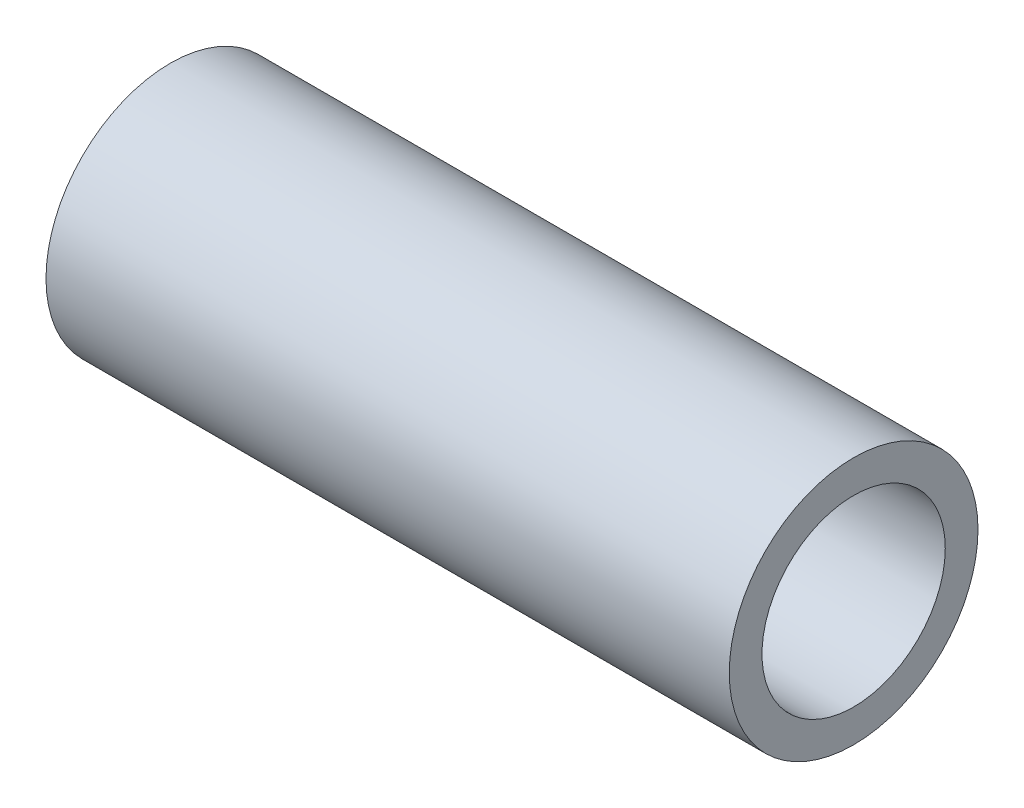
from build123d import *

# Parameters (mm, degrees)
SKETCH1_R           = 9.652
SKETCH1_R_2         = 7.112
BOSS_EXTRUDE1_DEPTH = 53.02758


with BuildPart() as part:
    # Sketch1 → Boss-Extrude1 (new body)
    with BuildSketch(Plane(origin=(0, 0, 0), x_dir=(0, 0, -1), z_dir=(1, 0, 0))):
        Circle(SKETCH1_R)
        Circle(SKETCH1_R_2, mode=Mode.SUBTRACT)
    extrude(amount=BOSS_EXTRUDE1_DEPTH)


solid = part.part
